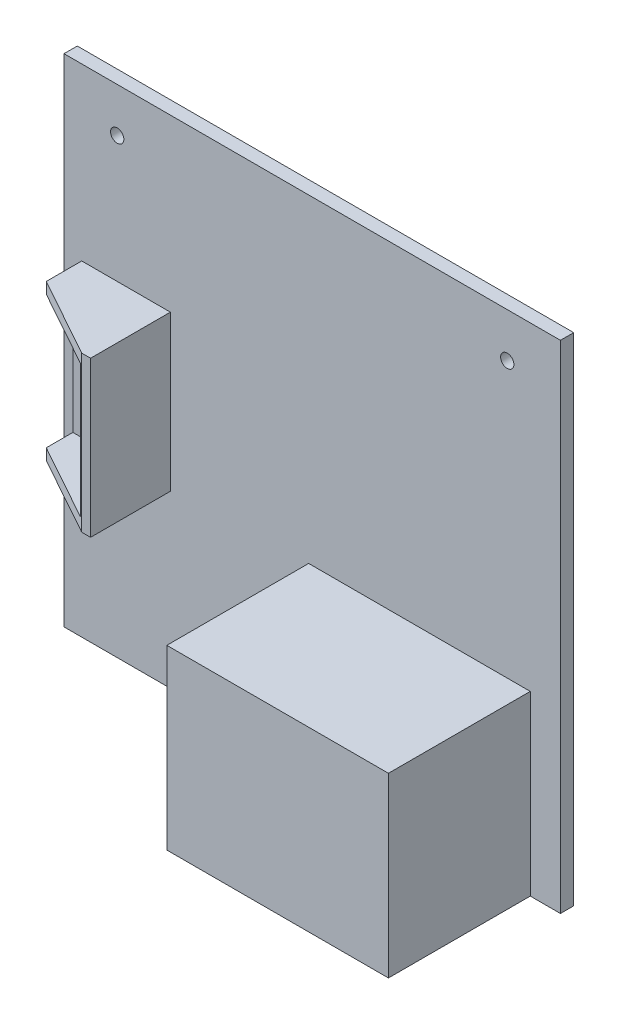
from build123d import *

# Parameters (mm, degrees)
CROQUIS1_W              = 112
CROQUIS1_H              = 112
SALIENTE_EXTRUIR1_DEPTH = 3
CROQUIS2_W              = 50
CROQUIS2_H              = 40
SALIENTE_EXTRUIR2_DEPTH = 32
CROQUIS3_W              = 20
CROQUIS3_H              = 35
SALIENTE_EXTRUIR3_DEPTH = 18
CROQUIS4_W              = 17.5
CROQUIS4_H              = 30
CORTAR_EXTRUIR1_DEPTH   = 16
CORTAR_EXTRUIR2_DEPTH   = 46
CROQUIS6_R              = 1.5
CORTAR_EXTRUIR3_DEPTH   = 46


with BuildPart() as part:
    # Croquis1 → Saliente-Extruir1 (new body)
    with BuildSketch(Plane.XY):
        Rectangle(CROQUIS1_W, CROQUIS1_H)
    extrude(amount=SALIENTE_EXTRUIR1_DEPTH)

    # Croquis2 → Saliente-Extruir2 (add)
    with BuildSketch(Plane.XY.offset(3)):
        with Locations((24.197, -36)):
            Rectangle(CROQUIS2_W, CROQUIS2_H)
    extrude(amount=SALIENTE_EXTRUIR2_DEPTH)

    # Croquis3 → Saliente-Extruir3 (add)
    with BuildSketch(Plane.XY.offset(3)):
        with Locations((-42, 0)):
            Rectangle(CROQUIS3_W, CROQUIS3_H)
    extrude(amount=SALIENTE_EXTRUIR3_DEPTH)

    # Croquis4 → Cortar-Extruir1 (cut)
    with BuildSketch(Plane.XY.offset(21)):
        with Locations((-43.25, 0)):
            Rectangle(CROQUIS4_W, CROQUIS4_H)
    extrude(amount=-CORTAR_EXTRUIR1_DEPTH, mode=Mode.SUBTRACT)

    # Croquis5 → Cortar-Extruir2 (cut)
    with BuildSketch(Plane.XZ.offset(17.5)):
        Polygon((-52, 21), (-52, 11), (-34.000297752, 21), align=None)
    extrude(amount=-CORTAR_EXTRUIR2_DEPTH, mode=Mode.SUBTRACT)

    # Croquis6 → Cortar-Extruir3 (cut)
    with BuildSketch(Plane.XY.offset(3)):
        with Locations((-44, 46)):
            Circle(CROQUIS6_R)
        with Locations((44, 46)):
            Circle(CROQUIS6_R)
        with Locations((-6.803, -46)):
            Circle(CROQUIS6_R)
    extrude(amount=-CORTAR_EXTRUIR3_DEPTH, mode=Mode.SUBTRACT)


solid = part.part
